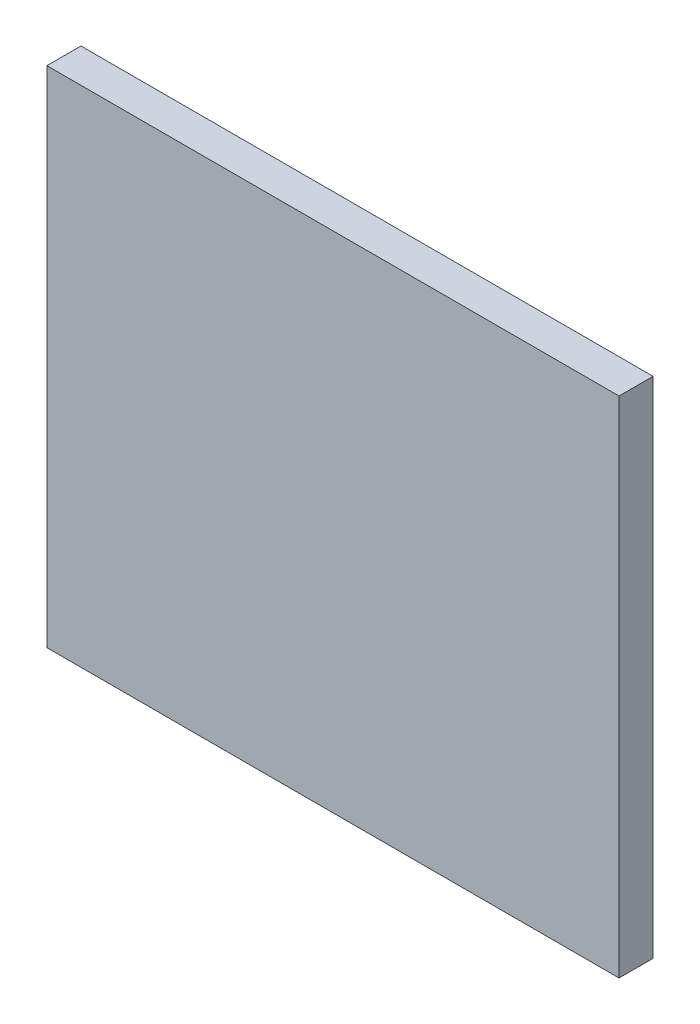
from build123d import *

# Parameters (mm, degrees)
CROQUIS1_W              = 84
CROQUIS1_H              = 74
SALIENTE_EXTRUIR1_DEPTH = 5


with BuildPart() as part:
    # Croquis1 → Saliente-Extruir1 (new body)
    with BuildSketch(Plane.XY):
        with Locations((-142.540740741, 113.888888889)):
            Rectangle(CROQUIS1_W, CROQUIS1_H)
    extrude(amount=SALIENTE_EXTRUIR1_DEPTH)


solid = part.part
